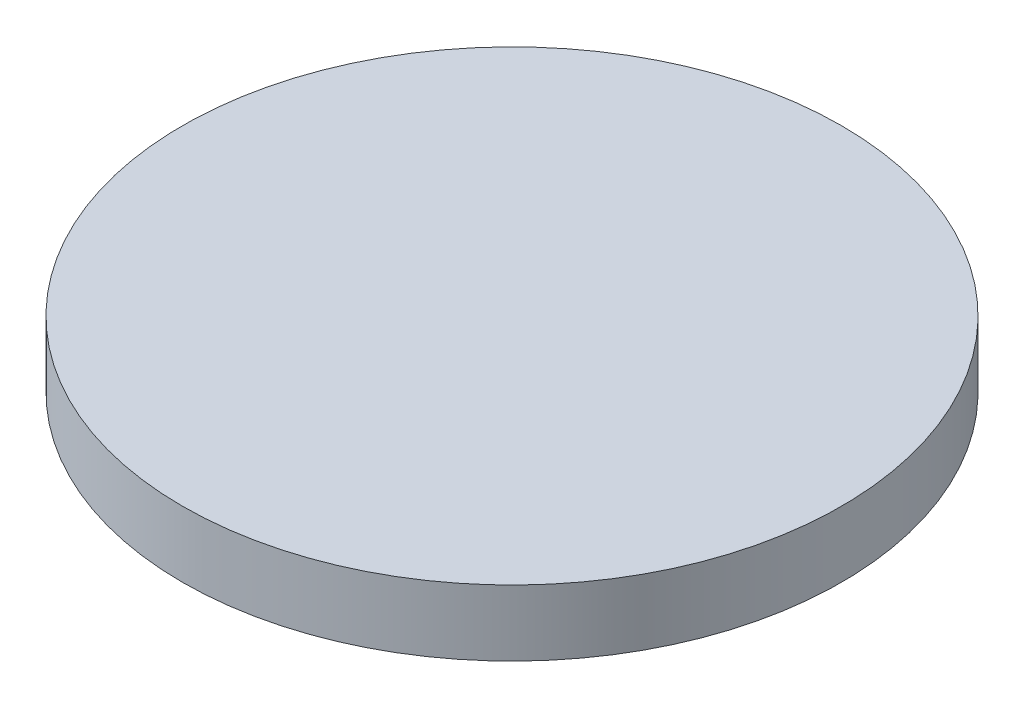
from build123d import *

# Parameters (mm, degrees)
CROQUIS1_R              = 50
SALIENTE_EXTRUIR1_DEPTH = 10


with BuildPart() as part:
    # Croquis1 → Saliente-Extruir1 (new body)
    with BuildSketch(Plane(origin=(0, 0, 0), x_dir=(1, 0, 0), z_dir=(0, 1, 0))):
        with Locations(Location((0, 0, 0), (0, 0, 270))):
            Circle(CROQUIS1_R)
    extrude(amount=SALIENTE_EXTRUIR1_DEPTH)


solid = part.part
